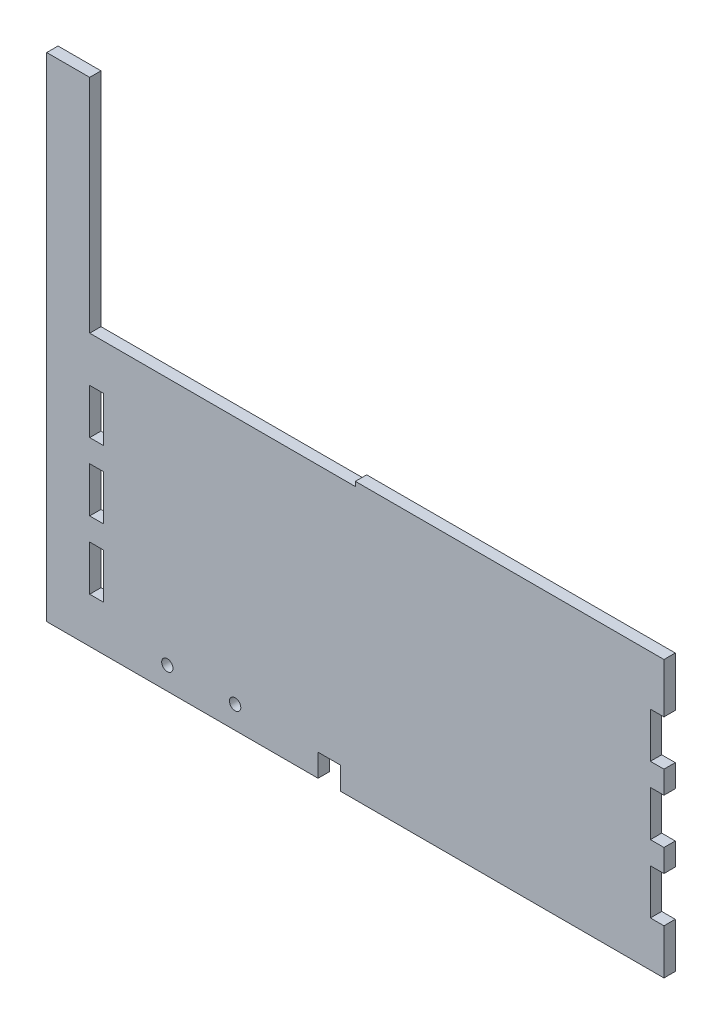
from build123d import *

# Parameters (mm, degrees)
SKETCH1_W           = 273
SKETCH1_H           = 122
BOSS_EXTRUDE1_DEPTH = 5
SKETCH2_W           = 19
SKETCH2_H           = 96
BOSS_EXTRUDE2_DEPTH = 5
SKETCH3_W           = 6
SKETCH3_H           = 20
CUT_EXTRUDE1_DEPTH  = 6
SKETCH6_W           = 117.5
SKETCH6_H           = 2
CUT_EXTRUDE3_DEPTH  = 6
CUT_EXTRUDE4_DEPTH  = 10
SKETCH8_W           = 10
SKETCH8_H           = 10
CUT_EXTRUDE5_DEPTH  = 10


with BuildPart() as part:
    # Sketch1 → Boss-Extrude1 (new body)
    with BuildSketch(Plane.XY):
        Rectangle(SKETCH1_W, SKETCH1_H)
    extrude(amount=BOSS_EXTRUDE1_DEPTH)

    # Sketch2 → Boss-Extrude2 (add)
    with BuildSketch(Plane.XY.offset(5)):
        with Locations((-127, 109)):
            Rectangle(SKETCH2_W, SKETCH2_H)
    extrude(amount=-BOSS_EXTRUDE2_DEPTH)

    # Sketch3 → Cut-Extrude1 (cut)
    with BuildSketch(Plane.XY.offset(5)):
        with Locations((-114.5, 29)):
            Rectangle(SKETCH3_W, SKETCH3_H)
        with Locations((-114.5, -1)):
            Rectangle(SKETCH3_W, SKETCH3_H)
        with Locations((-114.5, -31)):
            Rectangle(SKETCH3_W, SKETCH3_H)
        with Locations((133.5, 29)):
            Rectangle(SKETCH3_W, SKETCH3_H)
        with Locations((133.5, -1)):
            Rectangle(SKETCH3_W, SKETCH3_H)
        with Locations((133.5, -31)):
            Rectangle(SKETCH3_W, SKETCH3_H)
    extrude(amount=-CUT_EXTRUDE1_DEPTH, mode=Mode.SUBTRACT)

    # Sketch6 → Cut-Extrude3 (cut)
    with BuildSketch(Plane.XY.offset(5)):
        with Locations((-58.75, 60)):
            Rectangle(SKETCH6_W, SKETCH6_H)
    extrude(amount=-CUT_EXTRUDE3_DEPTH, mode=Mode.SUBTRACT)

    # Sketch7 → Cut-Extrude4 (cut)
    with BuildSketch(Plane.XY.offset(5)):
        with BuildLine():
            ThreePointArc((-80.670694004, -51), (-84.938460957, -49.232233047), (-83.170694004, -53.5))
            Line((-83.170694004, -53.5), (-83.170694004, -51))
            Line((-83.170694004, -51), (-80.670694004, -51))
        make_face()
        with BuildLine():
            Line((-83.170694004, -51), (-83.170694004, -53.5))
            ThreePointArc((-83.170694004, -53.5), (-81.402927051, -52.767766953), (-80.670694004, -51))
            Line((-80.670694004, -51), (-83.170694004, -51))
        make_face()
        with BuildLine():
            ThreePointArc((-55.670694004, -51), (-54.938460957, -52.767766953), (-53.170694004, -53.5))
            Line((-53.170694004, -53.5), (-53.170694004, -51))
            Line((-53.170694004, -51), (-55.670694004, -51))
        make_face()
        with BuildLine():
            Line((-53.170694004, -51), (-53.170694004, -53.5))
            ThreePointArc((-53.170694004, -53.5), (-51.402927051, -52.767766953), (-50.670694004, -51))
            ThreePointArc((-50.670694004, -51), (-53.170694004, -48.5), (-55.670694004, -51))
            Line((-55.670694004, -51), (-53.170694004, -51))
        make_face()
    extrude(amount=-CUT_EXTRUDE4_DEPTH, mode=Mode.SUBTRACT)

    # Sketch8 → Cut-Extrude5 (cut)
    with BuildSketch(Plane.XY.offset(5)):
        with Locations((-11.5, -56)):
            Rectangle(SKETCH8_W, SKETCH8_H)
    extrude(amount=-CUT_EXTRUDE5_DEPTH, mode=Mode.SUBTRACT)


solid = part.part
